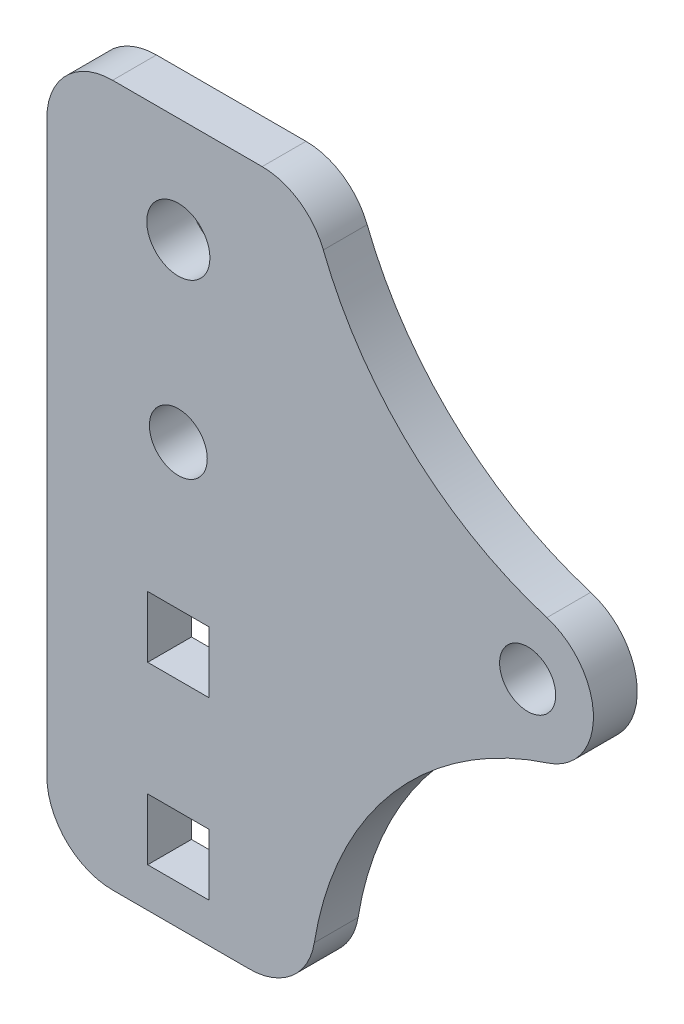
from build123d import *

# Parameters (mm, degrees)
SKETCH1_R           = 2.032
SKETCH1_R_2         = 2.286
SKETCH1_R_3         = 2.0955
SKETCH1_W           = 4.445
SKETCH1_H           = 4.445
BOSS_EXTRUDE1_DEPTH = 3.175
FILLET1_R           = 4.7625


with BuildPart() as part:
    # Sketch1 → Boss-Extrude1 (new body)
    with BuildSketch(Plane.XY):
        with BuildLine():
            Line((-9.525, -30.48), (-9.525, 20.32))
            Line((-9.525, 20.32), (9.525, 20.32))
            ThreePointArc((9.525, 20.32), (15.760681597, 9.08548638), (26.69688421, 2.340303383))
            ThreePointArc((26.69688421, 2.340303383), (30.065673036, -2.173245584), (26.774154282, -6.743449816))
            ThreePointArc((26.774154282, -6.743449816), (14.292700247, -15.808964436), (9.525, -30.48))
            Line((9.525, -30.48), (-9.525, -30.48))
        make_face()
        with Locations((25.303345332, -2.213755866)):
            Circle(SKETCH1_R, mode=Mode.SUBTRACT)
        with Locations((0, 12.7)):
            Circle(SKETCH1_R_2, mode=Mode.SUBTRACT)
        Circle(SKETCH1_R_3, mode=Mode.SUBTRACT)
        with Locations((0, -25.4)):
            Rectangle(SKETCH1_W, SKETCH1_H, mode=Mode.SUBTRACT)
        with Locations((0, -12.7)):
            Rectangle(SKETCH1_W, SKETCH1_H, mode=Mode.SUBTRACT)
    extrude(amount=BOSS_EXTRUDE1_DEPTH)

    # Fillet1
    fillet1_edges = [part.edges().sort_by_distance(p)[0] for p in [
        (-9.525, -30.48, 1.5875),
        (9.525, 20.32, 1.5875),
        (-9.525, 20.32, 1.5875),
        (9.525, -30.48, 1.5875),
    ]]
    fillet(fillet1_edges, radius=FILLET1_R)


solid = part.part
